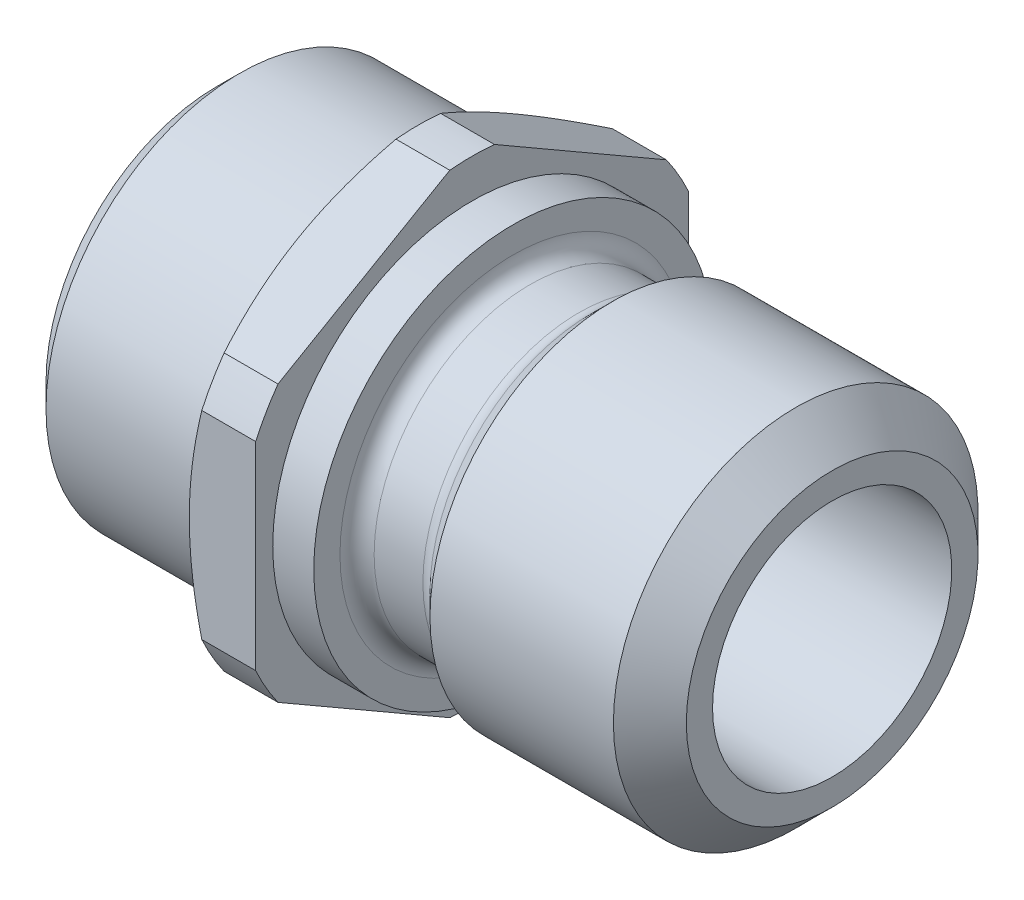
from build123d import *

# Parameters (mm, degrees)
SKETCH_2_OUTSIDE_W  = 30.906
SKETCH_2_OUTSIDE_H  = 30.906
CUT_EXTRUDE_1_DEPTH = 25.070832973
SKETCH_3_OUTSIDE_W  = 114.288
SKETCH_3_OUTSIDE_H  = 116.188
SKETCH_3_OUTSIDE_R  = 9
CUT_EXTRUDE_2_DEPTH = 24.673878009
CUT_EXTRUDE_2_DRAFT = -60
SKETCH_4_OUTSIDE_W  = 28.814
SKETCH_4_OUTSIDE_H  = 30.714
SKETCH_4_OUTSIDE_R  = 8.75
CUT_EXTRUDE_3_DEPTH = 1.8


with BuildPart() as part:
    # Эскиз1 → Повернуть1 (revolve)
    with BuildSketch(Plane.XY, mode=Mode.PRIVATE) as revolve_1_sk:
        with BuildLine():
            Line((0, 3), (0, 7.5))
            Line((0, 7.5), (1, 8.5))
            Line((1, 8.5), (8, 8.5))
            Line((8, 8.5), (8, 10.45))
            Line((8, 10.45), (13, 10.45))
            Line((13, 10.45), (13, 7.6))
            ThreePointArc((13, 7.6), (13.219669914, 7.069669914), (13.75, 6.85))
            Line((13.75, 6.85), (15.889339828, 6.85))
            ThreePointArc((15.889339828, 6.85), (16.176352402, 6.907090351), (16.419669914, 7.069669914))
            Line((16.419669914, 7.069669914), (17.35, 8))
            Line((17.35, 8), (25.4, 8))
            Line((25.4, 8), (27, 6.4))
            Line((27, 6.4), (27, 5.25))
            Line((27, 5.25), (4, 5.25))
            ThreePointArc((4, 5.25), (3.292893219, 4.957106781), (3, 4.25))
            Line((3, 4.25), (3, 3))
            Line((3, 3), (0, 3))
        make_face()
    revolve(revolve_1_sk.sketch.rotate(Axis((0, 0, 0), (1, 0, 0)), 90), axis=Axis((0, 0, 0), (1, 0, 0)))

    # Эскиз2 outside → Вырез-Вытянуть1 (cut, through all)
    with BuildSketch(Plane.ZY.offset(-8)):
        Rectangle(SKETCH_2_OUTSIDE_W, SKETCH_2_OUTSIDE_H)
        Polygon((0, 10.969655115), (-9.5, 5.484827557), (-9.5, -5.484827557), (0, -10.969655115), (9.5, -5.484827557), (9.5, 5.484827557), align=None, mode=Mode.SUBTRACT)
    extrude(amount=-CUT_EXTRUDE_1_DEPTH, mode=Mode.SUBTRACT)


with BuildPart() as cut_extrude_2_tool:
    # Эскиз3 outside → Вырез-Вытянуть2 (with draft: the straight prism first)
    with BuildSketch(Plane.ZY.offset(-8)):
        Rectangle(SKETCH_3_OUTSIDE_W, SKETCH_3_OUTSIDE_H)
        Circle(SKETCH_3_OUTSIDE_R, mode=Mode.SUBTRACT)
    extrude(amount=-CUT_EXTRUDE_2_DEPTH)
    # Вырез-Вытянуть2: the draft: its side faces are tilted about the plane it starts from
    cut_extrude_2_sides = [cut_extrude_2_tool.faces().sort_by_distance(p)[0] for p in [
        (20.336939005, -58.094, 0),
        (20.336939005, 0, 57.144),
        (20.336939005, 58.094, 0),
        (20.336939005, 0, -57.144),
        (20.336939005, 0, -9),
    ]]
    draft(cut_extrude_2_sides, Plane.ZY.offset(-8), CUT_EXTRUDE_2_DRAFT)


with BuildPart() as part_1:
    add(part.part)

    # Вырез-Вытянуть2: cut by cut_extrude_2_tool
    add(cut_extrude_2_tool.part, mode=Mode.SUBTRACT)

    # Эскиз4 outside → Вырез-Вытянуть3 (cut)
    with BuildSketch(Plane(origin=(13, 0, 0), x_dir=(0, 0, -1), z_dir=(1, 0, 0))):
        Rectangle(SKETCH_4_OUTSIDE_W, SKETCH_4_OUTSIDE_H)
        Circle(SKETCH_4_OUTSIDE_R, mode=Mode.SUBTRACT)
    extrude(amount=-CUT_EXTRUDE_3_DEPTH, mode=Mode.SUBTRACT)


solid = part_1.part
